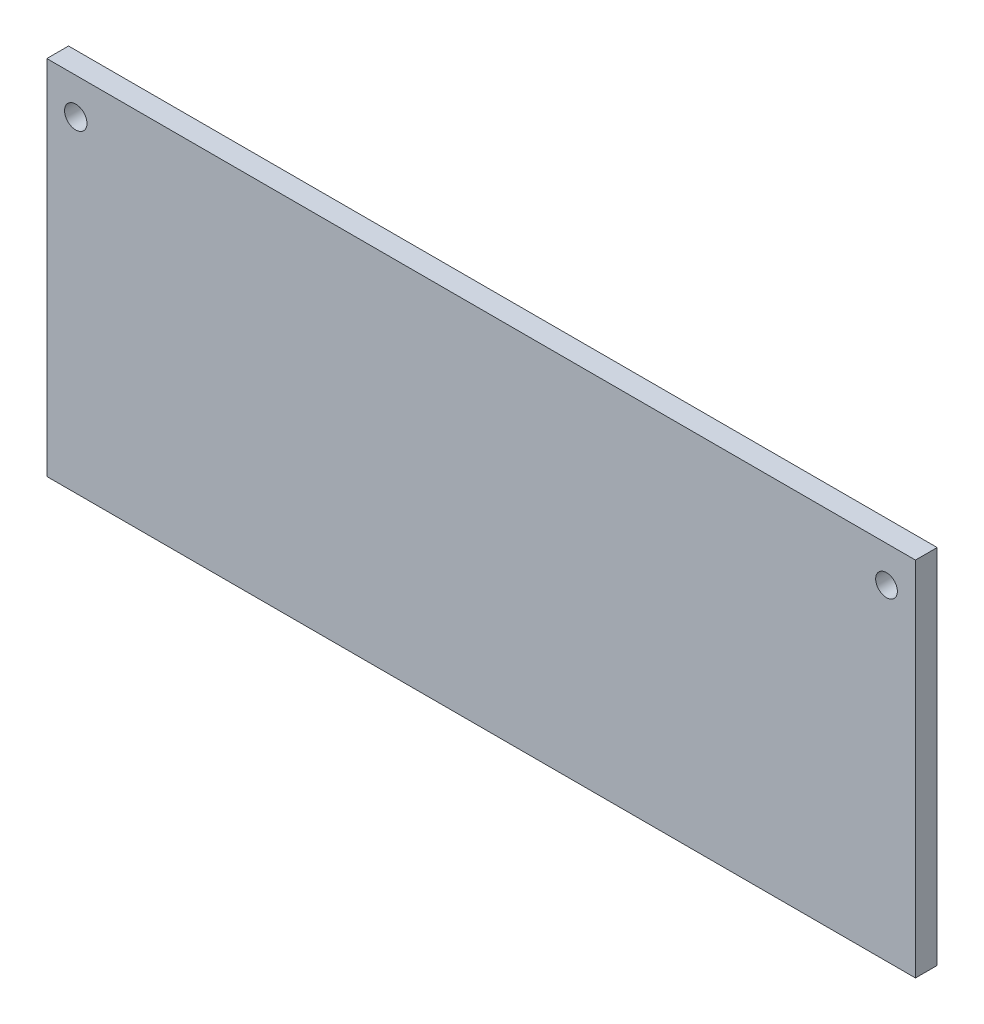
from build123d import *

# Parameters (mm, degrees)
SKETCH_1_W          = 120
SKETCH_1_H          = 50
EXTRUDE_1_DEPTH     = 3
SKETCH_3_R          = 1.5
SKETCH_3_R_2        = 1.55
CUT_EXTRUDE_2_DEPTH = 10


with BuildPart() as part:
    # 草图1 → 凸台-拉伸1 (new body)
    with BuildSketch(Plane.XY):
        Rectangle(SKETCH_1_W, SKETCH_1_H)
    extrude(amount=EXTRUDE_1_DEPTH)

    # 草图3 → 切除-拉伸2 (cut)
    with BuildSketch(Plane(origin=(0, 0, 0), x_dir=(-1, 0, 0), z_dir=(0, 0, -1))):
        with Locations((-56, 20)):
            Circle(SKETCH_3_R)
        with Locations((56, 20)):
            Circle(SKETCH_3_R_2)
    extrude(amount=-CUT_EXTRUDE_2_DEPTH, mode=Mode.SUBTRACT)


solid = part.part
